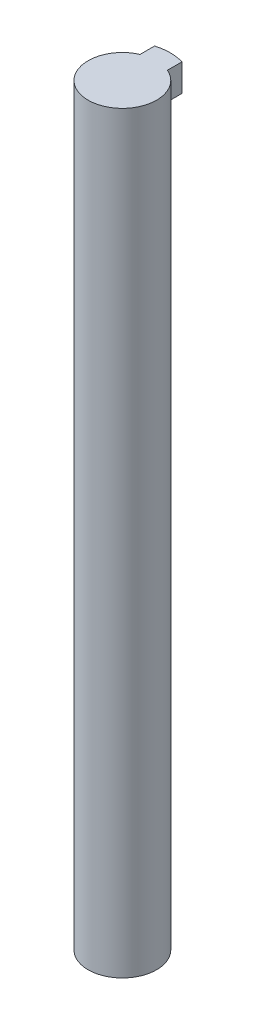
from build123d import *

# Parameters (mm, degrees)
SKETCH1_R           = 3.175
BOSS_EXTRUDE1_DEPTH = 69.85
BOSS_EXTRUDE2_START = -2.54
BOSS_EXTRUDE2_DEPTH = 2.54


with BuildPart() as part:
    # Sketch1 → Boss-Extrude1 (new body)
    with BuildSketch(Plane(origin=(0, 0, 0), x_dir=(1, 0, 0), z_dir=(0, 1, 0))):
        with Locations(Location((0, 0, 0), (0, 0, 270))):
            Circle(SKETCH1_R)
    extrude(amount=BOSS_EXTRUDE1_DEPTH)

    # Sketch2 → Boss-Extrude2 (add)
    with BuildSketch(Plane(origin=(0, 69.85, 0), x_dir=(1, 0, 0), z_dir=(0, 1, 0)).offset(BOSS_EXTRUDE2_START)):
        with BuildLine():
            Line((1.27, 4.259709497), (1.27, 2.909935566))
            ThreePointArc((1.27, 2.909935566), (0, 3.175), (-1.27, 2.909935566))
            Line((-1.27, 2.909935566), (-1.27, 4.259709497))
            ThreePointArc((-1.27, 4.259709497), (0, 4.445), (1.27, 4.259709497))
        make_face()
    extrude(amount=BOSS_EXTRUDE2_DEPTH)


solid = part.part
